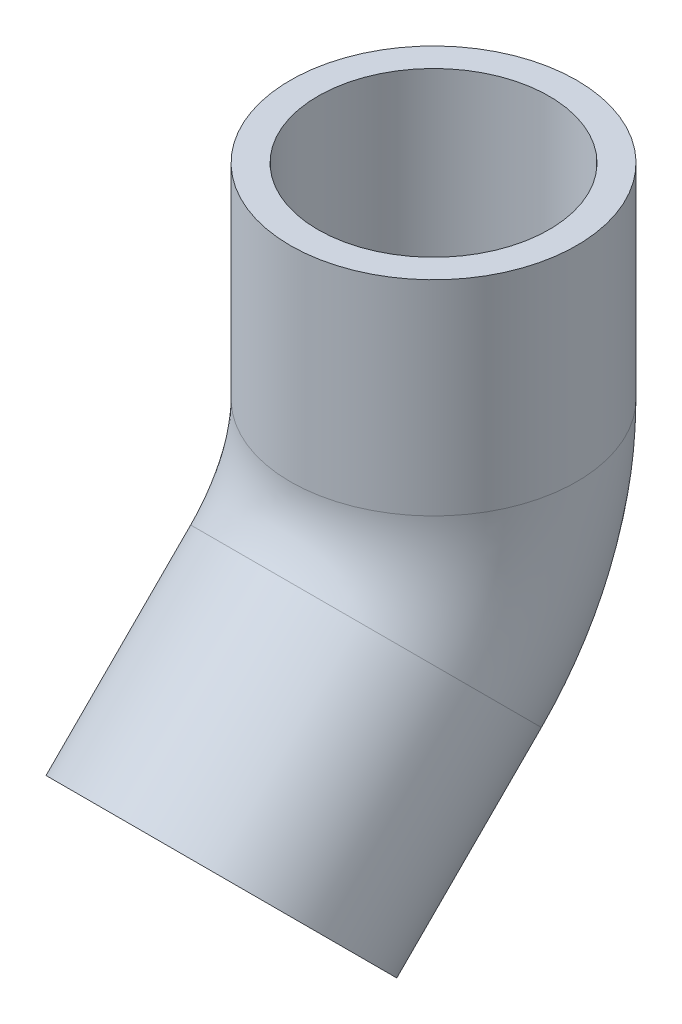
from build123d import *

# Parameters (mm, degrees)
SKETCH3_R          = 16.66875
SKETCH3_R_2        = 10.4648
SKETCH4_R          = 13.462
CUT_EXTRUDE1_DEPTH = 23.8125
SKETCH5_R          = 13.462
CUT_EXTRUDE2_DEPTH = 23.8125


with BuildPart() as part:
    # Sweep1: sweep along a path in Sketch2
    with BuildLine(Plane(origin=(0, 0, 0), x_dir=(0, 0, -1), z_dir=(1, 0, 0))) as sweep1_path:
        Line((-24.695704333, -24.695704333), (-7.857724106, -7.857724106))
        ThreePointArc((-7.857724106, -7.857724106), (-2.04215596, 0.845888695), (0, 11.1125))
        Line((0, 11.1125), (0, 34.925))
    # Sketch3 → Sweep1 (sweep)
    with BuildSketch(Plane(origin=(0, 34.925, 0), x_dir=(1, 0, 0), z_dir=(0, 1, 0))):
        Circle(SKETCH3_R)
        Circle(SKETCH3_R_2, mode=Mode.SUBTRACT)
    sweep(path=sweep1_path.line)

    # Sketch4 → Cut-Extrude1 (cut)
    with BuildSketch(Plane(origin=(0, 34.925, 0), x_dir=(1, 0, 0), z_dir=(0, 1, 0))):
        with Locations(Location((0, 0, 0), (0, 0, 270))):
            Circle(SKETCH4_R)
    extrude(amount=-CUT_EXTRUDE1_DEPTH, mode=Mode.SUBTRACT)

    # Sketch5 → Cut-Extrude2 (cut)
    with BuildSketch(Plane(origin=(0, -24.695704333, 24.695704333), x_dir=(1, 0, 0), z_dir=(0, -0.7071067811865559, 0.7071067811865392))):
        with Locations(Location((0, 0, 0), (0, 0, 270))):
            Circle(SKETCH5_R)
    extrude(amount=-CUT_EXTRUDE2_DEPTH, mode=Mode.SUBTRACT)


solid = part.part
